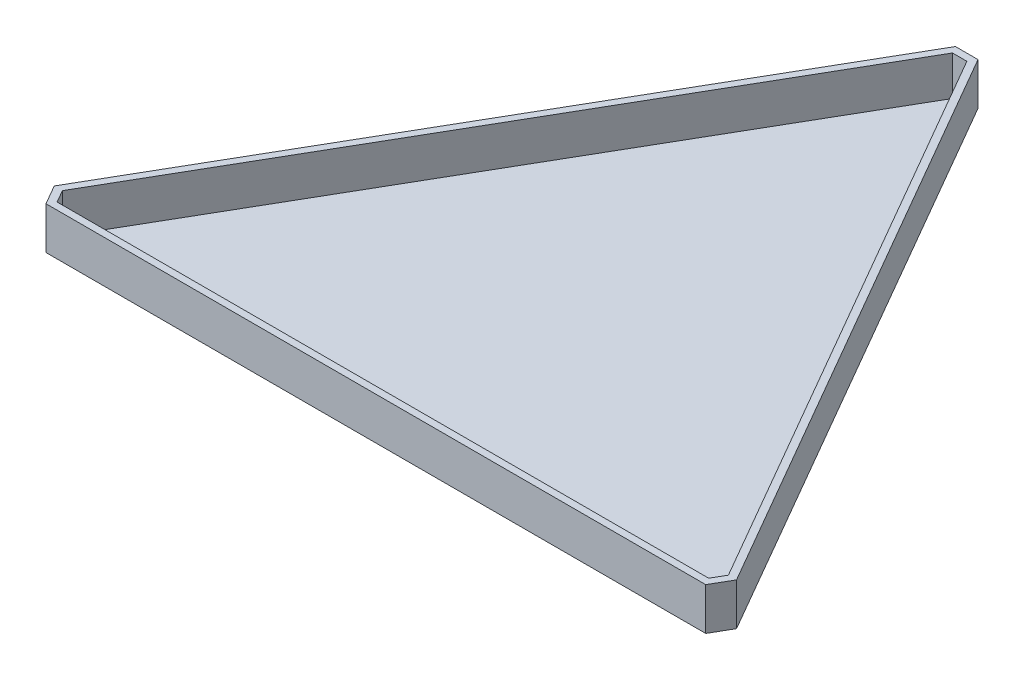
from build123d import *

# Parameters (mm, degrees)
BOSS_EXTRUDE6_DEPTH = 1
BOSS_EXTRUDE8_DEPTH = 15


with BuildPart() as part:
    # Sketch1 → Boss-Extrude6 (new body)
    with BuildSketch(Plane(origin=(0, 0, 0), x_dir=(1, 0, 0), z_dir=(0, 1, 0))):
        Polygon((231.716666588, -139.412373829), (462.829865412, -139.412373829), (465.38624875, -134.984588004), (349.829542096, 65.165499075), (344.716133219, 65.165499075), (229.159432538, -134.984249178), align=None)
    extrude(amount=BOSS_EXTRUDE6_DEPTH)

    # Sketch1<7> → Boss-Extrude8 (add)
    with BuildSketch(Plane(origin=(0, 0, 0), x_dir=(1, 0, 0), z_dir=(0, 1, 0))):
        Polygon((351.272917769, 67.665499075), (468.273000096, -134.984588004), (464.273241085, -141.912373829), (230.273290915, -141.912373829), (226.272682946, -134.984246139), (343.272757546, 67.665499075), align=None)
        Polygon((231.716666588, -139.412373829), (462.829865412, -139.412373829), (465.38624875, -134.984588004), (349.829542096, 65.165499075), (344.716133219, 65.165499075), (229.159432538, -134.984249178), align=None, mode=Mode.SUBTRACT)
    extrude(amount=BOSS_EXTRUDE8_DEPTH)


solid = part.part
